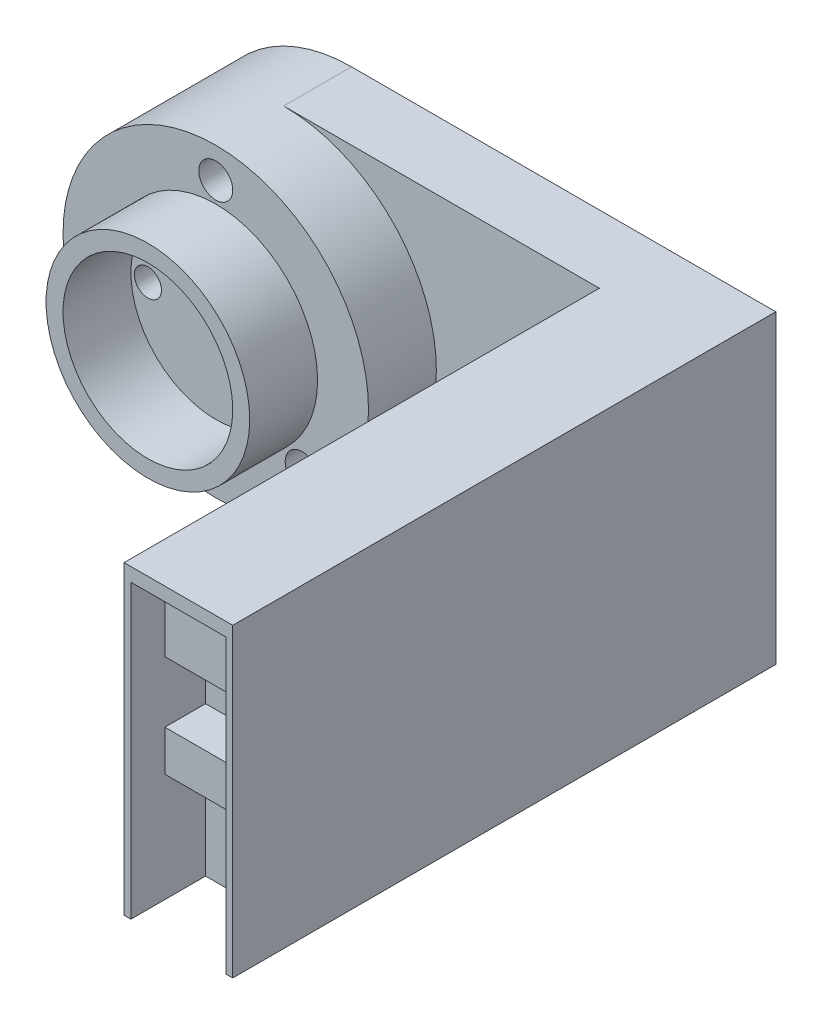
from build123d import *

# Parameters (mm, degrees)
SKETCH1_R           = 22.5
BOSS_EXTRUDE1_DEPTH = 20
SKETCH11_W          = 62.5
SKETCH11_H          = 45
BOSS_EXTRUDE4_DEPTH = 10
SKETCH6_R           = 15
BOSS_EXTRUDE2_DEPTH = 10
SKETCH7_R           = 12.5
CUT_EXTRUDE1_DEPTH  = 10
SKETCH8_R           = 2
CUT_EXTRUDE3_DEPTH  = 70.372184628
SKETCH9_R           = 2.5
CUT_EXTRUDE4_DEPTH  = 10
SKETCH12_W          = 16
SKETCH12_H          = 45
BOSS_EXTRUDE5_DEPTH = 70
SKETCH13_W          = 14
SKETCH13_H          = 43
CUT_EXTRUDE5_DEPTH  = 5
SKETCH14_W          = 9
SKETCH14_H          = 9
SKETCH14_W_2        = 14
SKETCH14_H_2        = 16
CUT_EXTRUDE6_DEPTH  = 6
CUT_EXTRUDE7_DEPTH  = 10


with BuildPart() as part:
    # Sketch1 → Boss-Extrude1 (new body)
    with BuildSketch(Plane.XY):
        Circle(SKETCH1_R)
    extrude(amount=BOSS_EXTRUDE1_DEPTH)

    # Sketch11 → Boss-Extrude4 (add)
    with BuildSketch(Plane.XY):
        with Locations((31.25, 0)):
            Rectangle(SKETCH11_W, SKETCH11_H)
    extrude(amount=BOSS_EXTRUDE4_DEPTH)

    # Sketch6 → Boss-Extrude2 (add)
    with BuildSketch(Plane.XY.offset(20)):
        Circle(SKETCH6_R)
    extrude(amount=BOSS_EXTRUDE2_DEPTH)

    # Sketch7 → Cut-Extrude1 (cut)
    with BuildSketch(Plane.XY.offset(30)):
        Circle(SKETCH7_R)
    extrude(amount=-CUT_EXTRUDE1_DEPTH, mode=Mode.SUBTRACT)

    # Sketch8 → Cut-Extrude3 (cut, through all)
    with BuildSketch(Plane.XY.offset(20)):
        with Locations((-10, 0)):
            Circle(SKETCH8_R)
        with Locations((10, 0)):
            Circle(SKETCH8_R)
    extrude(amount=-CUT_EXTRUDE3_DEPTH, mode=Mode.SUBTRACT)

    # Sketch9 → Cut-Extrude4 (cut)
    with BuildSketch(Plane.XY.offset(20)):
        with Locations((0, 18)):
            Circle(SKETCH9_R)
        with Locations((-12.727922061, -12.727922061)):
            Circle(SKETCH9_R)
        with Locations((12.727922061, -12.727922061)):
            Circle(SKETCH9_R)
    extrude(amount=-CUT_EXTRUDE4_DEPTH, mode=Mode.SUBTRACT)

    # Sketch12 → Boss-Extrude5 (add)
    with BuildSketch(Plane.XY.offset(10)):
        with Locations((54.5, 0)):
            Rectangle(SKETCH12_W, SKETCH12_H)
    extrude(amount=BOSS_EXTRUDE5_DEPTH)

    # Sketch13 → Cut-Extrude5 (cut)
    with BuildSketch(Plane.XY.offset(80)):
        with Locations((54.5, -1)):
            Rectangle(SKETCH13_W, SKETCH13_H)
    extrude(amount=-CUT_EXTRUDE5_DEPTH, mode=Mode.SUBTRACT)

    # Sketch14 → Cut-Extrude6 (cut)
    with BuildSketch(Plane.XY.offset(75)):
        with Locations((52, 4)):
            Rectangle(SKETCH14_W, SKETCH14_H)
        with Locations((54.5, -14.5)):
            Rectangle(SKETCH14_W_2, SKETCH14_H_2)
    extrude(amount=-CUT_EXTRUDE6_DEPTH, mode=Mode.SUBTRACT)

    # Sketch17 → Cut-Extrude7 (cut)
    with BuildSketch(Plane(origin=(0, 0, 0), x_dir=(-1, 0, 0), z_dir=(0, 0, -1))):
        Polygon((-10, 2), (-10, 4), (24, 4), (24, -4), (-10, -4), (-10, -2), align=None)
    extrude(amount=-CUT_EXTRUDE7_DEPTH, mode=Mode.SUBTRACT)


solid = part.part
